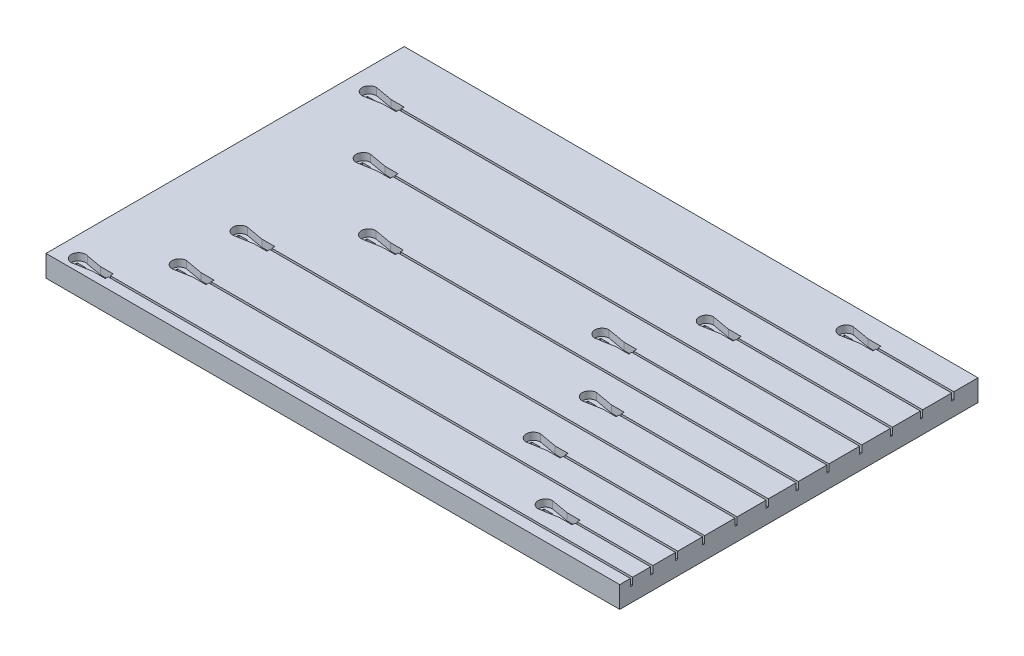
from build123d import *

# Parameters (mm, degrees)
SKETCH1_W           = 800.1
SKETCH1_H           = 499.618
BOSS_EXTRUDE1_DEPTH = 30
CUT_EXTRUDE3_DEPTH  = 10
SKETCH3_W           = 11.904533089
SKETCH3_H           = 7.577050726
SKETCH3_W_2         = 11.121408268
SKETCH3_H_2         = 7.09624417
SKETCH3_H_3         = 7.577050727
SKETCH3_W_3         = 11.90453309
CUT_EXTRUDE5_DEPTH  = 473.06412592


with BuildPart() as part:
    # Sketch1 → Boss-Extrude1 (new body)
    with BuildSketch(Plane(origin=(0, 0, 0), x_dir=(1, 0, 0), z_dir=(0, 1, 0))):
        Rectangle(SKETCH1_W, SKETCH1_H)
    extrude(amount=-BOSS_EXTRUDE1_DEPTH)

    # Sketch2 → Cut-Extrude3 (cut)
    with BuildSketch(Plane(origin=(0, 0, 0), x_dir=(1, 0, 0), z_dir=(0, 1, 0))):
        with BuildLine():
            ThreePointArc((251.366710834, 224.582705951), (241.366710834, 214.582705951), (251.366710834, 204.582705951))
            Line((251.366710834, 204.582705951), (276.258710834, 208.994705951))
            Line((276.258710834, 208.994705951), (294.241910834, 208.994705951))
            Line((294.241910834, 208.994705951), (294.241910834, 213.082705951))
            Line((294.241910834, 213.082705951), (400.05, 213.082705951))
            Line((400.05, 213.082705951), (400.05, 216.082705951))
            Line((400.05, 216.082705951), (294.241910834, 216.082705951))
            Line((294.241910834, 216.082705951), (294.241910834, 220.170705951))
            Line((294.241910834, 220.170705951), (276.258710834, 220.170705951))
            Line((276.258710834, 220.170705951), (251.366710834, 224.582705951))
        make_face()
        with BuildLine():
            ThreePointArc((-369.945334755, 181.04073751), (-379.945334755, 171.04073751), (-369.945334755, 161.04073751))
            Line((-369.945334755, 161.04073751), (-345.053334755, 165.45273751))
            Line((-345.053334755, 165.45273751), (-327.070134755, 165.45273751))
            Line((-327.070134755, 165.45273751), (-327.070134755, 169.54073751))
            Line((-327.070134755, 169.54073751), (400.05, 169.54073751))
            Line((400.05, 169.54073751), (400.05, 172.54073751))
            Line((400.05, 172.54073751), (-327.070134755, 172.54073751))
            Line((-327.070134755, 172.54073751), (-327.070134755, 176.62873751))
            Line((-327.070134755, 176.62873751), (-345.053334755, 176.62873751))
            Line((-345.053334755, 176.62873751), (-369.945334755, 181.04073751))
        make_face()
        with BuildLine():
            ThreePointArc((142.116905381, 138.983812763), (132.116905381, 128.983812763), (142.116905381, 118.983812763))
            Line((142.116905381, 118.983812763), (167.008905381, 123.395812763))
            Line((167.008905381, 123.395812763), (184.992105381, 123.395812763))
            Line((184.992105381, 123.395812763), (184.992105381, 127.483812763))
            Line((184.992105381, 127.483812763), (400.05, 127.483812763))
            Line((400.05, 127.483812763), (400.05, 130.483812763))
            Line((400.05, 130.483812763), (184.992105381, 130.483812763))
            Line((184.992105381, 130.483812763), (184.992105381, 134.571812763))
            Line((184.992105381, 134.571812763), (167.008905381, 134.571812763))
            Line((167.008905381, 134.571812763), (142.116905381, 138.983812763))
        make_face()
        with BuildLine():
            ThreePointArc((-293.579796741, 96.226149121), (-303.579796741, 86.226149121), (-293.579796741, 76.226149121))
            Line((-293.579796741, 76.226149121), (-268.687796741, 80.638149121))
            Line((-268.687796741, 80.638149121), (-250.704596741, 80.638149121))
            Line((-250.704596741, 80.638149121), (-250.704596741, 84.726149121))
            Line((-250.704596741, 84.726149121), (400.05, 84.726149121))
            Line((400.05, 84.726149121), (400.05, 87.726149121))
            Line((400.05, 87.726149121), (-250.704596741, 87.726149121))
            Line((-250.704596741, 87.726149121), (-250.704596741, 91.814149121))
            Line((-250.704596741, 91.814149121), (-268.687796741, 91.814149121))
            Line((-268.687796741, 91.814149121), (-293.579796741, 96.226149121))
        make_face()
        with BuildLine():
            ThreePointArc((85.005088044, 50.481051347), (75.005088044, 40.481051347), (85.005088044, 30.481051347))
            Line((85.005088044, 30.481051347), (109.897088044, 34.893051347))
            Line((109.897088044, 34.893051347), (127.880288044, 34.893051347))
            Line((127.880288044, 34.893051347), (127.880288044, 39.082302533))
            Line((127.880288044, 39.082302533), (400.05, 39.082302533))
            Line((400.05, 39.082302533), (400.05, 41.87980016))
            Line((400.05, 41.87980016), (127.880288044, 41.87980016))
            Line((127.880288044, 41.87980016), (127.880288044, 46.069051347))
            Line((127.880288044, 46.069051347), (109.897088044, 46.069051347))
            Line((109.897088044, 46.069051347), (85.005088044, 50.481051347))
        make_face()
        with BuildLine():
            ThreePointArc((-197.68138109, 7.718814402), (-207.68138109, -2.281185598), (-197.68138109, -12.281185598))
            Line((-197.68138109, -12.281185598), (-172.78938109, -7.869185598))
            Line((-172.78938109, -7.869185598), (-154.80618109, -7.869185598))
            Line((-154.80618109, -7.869185598), (-154.80618109, -3.781185598))
            Line((-154.80618109, -3.781185598), (400.05, -3.781185598))
            Line((400.05, -3.781185598), (400.05, -0.781185598))
            Line((400.05, -0.781185598), (-154.80618109, -0.781185598))
            Line((-154.80618109, -0.781185598), (-154.80618109, 3.306814402))
            Line((-154.80618109, 3.306814402), (-172.78938109, 3.306814402))
            Line((-172.78938109, 3.306814402), (-197.68138109, 7.718814402))
        make_face()
        with BuildLine():
            ThreePointArc((151.958331876, -34.023556795), (141.958331876, -44.023556795), (151.958331876, -54.023556795))
            Line((151.958331876, -54.023556795), (176.850331876, -49.611556795))
            Line((176.850331876, -49.611556795), (194.833531876, -49.611556795))
            Line((194.833531876, -49.611556795), (194.833531876, -45.523556795))
            Line((194.833531876, -45.523556795), (400.05, -45.523556795))
            Line((400.05, -45.523556795), (400.05, -42.523556795))
            Line((400.05, -42.523556795), (194.833531876, -42.523556795))
            Line((194.833531876, -42.523556795), (194.833531876, -38.435556795))
            Line((194.833531876, -38.435556795), (176.850331876, -38.435556795))
            Line((176.850331876, -38.435556795), (151.958331876, -34.023556795))
        make_face()
        with BuildLine():
            ThreePointArc((-291.578404305, -77.590018504), (-301.578404305, -87.590018504), (-291.578404305, -97.590018504))
            Line((-291.578404305, -97.590018504), (-266.686404305, -93.178018504))
            Line((-266.686404305, -93.178018504), (-248.703204305, -93.178018504))
            Line((-248.703204305, -93.178018504), (-248.703204305, -89.090018504))
            Line((-248.703204305, -89.090018504), (400.05, -89.090018504))
            Line((400.05, -89.090018504), (400.05, -86.090018504))
            Line((400.05, -86.090018504), (-248.703204305, -86.090018504))
            Line((-248.703204305, -86.090018504), (-248.703204305, -82.002018504))
            Line((-248.703204305, -82.002018504), (-266.686404305, -82.002018504))
            Line((-266.686404305, -82.002018504), (-291.578404305, -77.590018504))
        make_face()
        with BuildLine():
            ThreePointArc((-293.469089433, -160.470073486), (-303.469089433, -170.470073486), (-293.469089433, -180.470073486))
            Line((-293.469089433, -180.470073486), (-268.577089433, -176.058073486))
            Line((-268.577089433, -176.058073486), (-250.593889433, -176.058073486))
            Line((-250.593889433, -176.058073486), (-250.593889433, -171.970073486))
            Line((-250.593889433, -171.970073486), (400.05, -171.970073486))
            Line((400.05, -171.970073486), (400.05, -168.970073486))
            Line((400.05, -168.970073486), (-250.593889433, -168.970073486))
            Line((-250.593889433, -168.970073486), (-250.593889433, -164.882073486))
            Line((-250.593889433, -164.882073486), (-268.577089433, -164.882073486))
            Line((-268.577089433, -164.882073486), (-293.469089433, -160.470073486))
        make_face()
        with BuildLine():
            Line((-367.752506177, -242.730724205), (-346.297445197, -238.927906872))
            Line((-346.297445197, -238.927906872), (-328.314245197, -238.927906872))
            Line((-328.314245197, -238.927906872), (-328.314245197, -234.839906872))
            Line((-328.314245197, -234.839906872), (400.05, -234.839906872))
            Line((400.05, -234.839906872), (400.05, -231.839906872))
            Line((400.05, -231.839906872), (-328.314245197, -231.839906872))
            Line((-328.314245197, -231.839906872), (-328.314245197, -227.751906872))
            Line((-328.314245197, -227.751906872), (-346.297445197, -227.751906872))
            Line((-346.297445197, -227.751906872), (-367.752506177, -223.949089539))
            ThreePointArc((-367.752506177, -223.949089539), (-381.189445197, -233.339906872), (-367.752506177, -242.730724205))
        make_face()
        with BuildLine():
            ThreePointArc((162.65597334, -122.898191443), (152.65597334, -132.898191443), (162.65597334, -142.898191443))
            Line((162.65597334, -142.898191443), (187.54797334, -138.486191443))
            Line((187.54797334, -138.486191443), (205.53117334, -138.486191443))
            Line((205.53117334, -138.486191443), (205.53117334, -134.398191443))
            Line((205.53117334, -134.398191443), (400.05, -134.398191443))
            Line((400.05, -134.398191443), (400.05, -131.398191443))
            Line((400.05, -131.398191443), (205.53117334, -131.398191443))
            Line((205.53117334, -131.398191443), (205.53117334, -127.310191443))
            Line((205.53117334, -127.310191443), (187.54797334, -127.310191443))
            Line((187.54797334, -127.310191443), (162.65597334, -122.898191443))
        make_face()
        with BuildLine():
            ThreePointArc((251.685313442, -195.225966369), (241.685313442, -205.225966369), (251.685313442, -215.225966369))
            Line((251.685313442, -215.225966369), (276.577313442, -210.813966369))
            Line((276.577313442, -210.813966369), (294.560513442, -210.813966369))
            Line((294.560513442, -210.813966369), (294.560513442, -206.725966369))
            Line((294.560513442, -206.725966369), (400.05, -206.725966369))
            Line((400.05, -206.725966369), (400.05, -203.725966369))
            Line((400.05, -203.725966369), (294.560513442, -203.725966369))
            Line((294.560513442, -203.725966369), (294.560513442, -199.637966369))
            Line((294.560513442, -199.637966369), (276.577313442, -199.637966369))
            Line((276.577313442, -199.637966369), (251.685313442, -195.225966369))
        make_face()
    extrude(amount=-CUT_EXTRUDE3_DEPTH, mode=Mode.SUBTRACT)

    # Sketch3 → Cut-Extrude5 (cut, through all)
    with BuildSketch(Plane(origin=(0, -10, 0), x_dir=(1, 0, 0), z_dir=(0, 1, 0))):
        with Locations((251.366710834, 214.582705951)):
            Rectangle(SKETCH3_W, SKETCH3_H)
        with Locations((-369.773155385, 170.310554041)):
            Rectangle(SKETCH3_W_2, SKETCH3_H_2)
        with Locations((151.923147728, -44.040321007)):
            Rectangle(SKETCH3_W, SKETCH3_H_3)
        with Locations((85.038457639, 40.577081776)):
            Rectangle(SKETCH3_W, SKETCH3_H)
        with Locations((-197.727360818, -2.179904367)):
            Rectangle(SKETCH3_W_3, SKETCH3_H)
        with Locations((-291.751179531, -86.970771666)):
            Rectangle(SKETCH3_W, SKETCH3_H_3)
        with Locations((-371.006310039, -233.225562931)):
            Rectangle(SKETCH3_W, SKETCH3_H_3)
        with Locations((251.733319115, -205.02345989)):
            Rectangle(SKETCH3_W_3, SKETCH3_H)
        with Locations((-293.345303708, 86.692367874)):
            Rectangle(SKETCH3_W_3, SKETCH3_H_3)
        with Locations((142.110300403, 129.002635792)):
            Rectangle(SKETCH3_W, SKETCH3_H_3)
        with Locations((162.40665728, -132.761369807)):
            Rectangle(SKETCH3_W_3, SKETCH3_H_3)
        with Locations((-293.581129322, -170.528225575)):
            Rectangle(SKETCH3_W, SKETCH3_H_3)
    extrude(amount=-CUT_EXTRUDE5_DEPTH, mode=Mode.SUBTRACT)


solid = part.part
